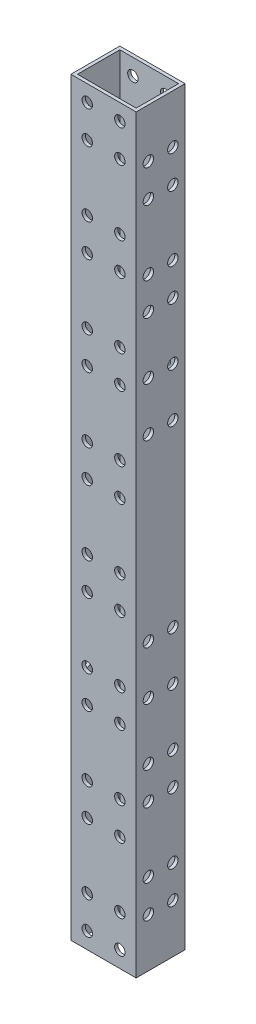
from build123d import *

# Parameters (mm, degrees)
SKETCH_1_W          = 20
SKETCH_1_H          = 15
SKETCH_1_W_2        = 18
SKETCH_1_H_2        = 13
EXTRUDE_1_DEPTH     = 230
SKETCH_3_R          = 1.6
CUT_EXTRUDE_1_DEPTH = 231.989718386
SKETCH_4_R          = 1.6
CUT_EXTRUDE_2_DEPTH = 231.705439901


with BuildPart() as part:
    # 草图1 → 拉伸-薄壁1 (new body)
    with BuildSketch(Plane(origin=(0, 0, 0), x_dir=(1, 0, 0), z_dir=(0, 1, 0))):
        Rectangle(SKETCH_1_W, SKETCH_1_H)
        Rectangle(SKETCH_1_W_2, SKETCH_1_H_2, mode=Mode.SUBTRACT)
    extrude(amount=EXTRUDE_1_DEPTH)

    # 草图3 → 切除-拉伸1 (cut, through all)
    with BuildSketch(Plane(origin=(10, 0, 0), x_dir=(0, 0, -1), z_dir=(1, 0, 0))):
        with Locations((-3.75, 157.5)):
            Circle(SKETCH_3_R)
        with Locations((-3.75, 142.5)):
            Circle(SKETCH_3_R)
        with Locations((3.75, 142.5)):
            Circle(SKETCH_3_R)
        with Locations((3.75, 157.5)):
            Circle(SKETCH_3_R)
        with Locations((-3.75, 87.5)):
            Circle(SKETCH_3_R)
        with Locations((3.75, 87.5)):
            Circle(SKETCH_3_R)
        with Locations((3.75, 72.5)):
            Circle(SKETCH_3_R)
        with Locations((-3.75, 72.5)):
            Circle(SKETCH_3_R)
        with Locations((-3.75, 215)):
            Circle(SKETCH_3_R)
        with Locations((3.75, 215)):
            Circle(SKETCH_3_R)
        with Locations((3.75, 205)):
            Circle(SKETCH_3_R)
        with Locations((-3.75, 205)):
            Circle(SKETCH_3_R)
        with Locations((-3.75, 185)):
            Circle(SKETCH_3_R)
        with Locations((3.75, 185)):
            Circle(SKETCH_3_R)
        with Locations((-3.75, 175)):
            Circle(SKETCH_3_R)
        with Locations((3.75, 175)):
            Circle(SKETCH_3_R)
        with Locations((3.75, 55)):
            Circle(SKETCH_3_R)
        with Locations((-3.75, 55)):
            Circle(SKETCH_3_R)
        with Locations((3.75, 45)):
            Circle(SKETCH_3_R)
        with Locations((-3.75, 45)):
            Circle(SKETCH_3_R)
        with Locations((-3.75, 25)):
            Circle(SKETCH_3_R)
        with Locations((3.75, 25)):
            Circle(SKETCH_3_R)
        with Locations((3.75, 15)):
            Circle(SKETCH_3_R)
        with Locations((-3.75, 15)):
            Circle(SKETCH_3_R)
    extrude(amount=-CUT_EXTRUDE_1_DEPTH, mode=Mode.SUBTRACT)

    # 草图4 → 切除-拉伸2 (cut, through all)
    with BuildSketch(Plane(origin=(0, 0, -7.5), x_dir=(-1, 0, 0), z_dir=(0, 0, -1))):
        with Locations((5, 225)):
            Circle(SKETCH_4_R)
        with Locations((-5, 225)):
            Circle(SKETCH_4_R)
        with Locations((5, 215)):
            Circle(SKETCH_4_R)
        with Locations((-5, 215)):
            Circle(SKETCH_4_R)
        with Locations((-5, 195)):
            Circle(SKETCH_4_R)
        with Locations((5, 195)):
            Circle(SKETCH_4_R)
        with Locations((-5, 185)):
            Circle(SKETCH_4_R)
        with Locations((5, 185)):
            Circle(SKETCH_4_R)
        with Locations((-5, 165)):
            Circle(SKETCH_4_R)
        with Locations((5, 165)):
            Circle(SKETCH_4_R)
        with Locations((-5, 155)):
            Circle(SKETCH_4_R)
        with Locations((5, 155)):
            Circle(SKETCH_4_R)
        with Locations((-5, 135)):
            Circle(SKETCH_4_R)
        with Locations((5, 135)):
            Circle(SKETCH_4_R)
        with Locations((-5, 125)):
            Circle(SKETCH_4_R)
        with Locations((5, 125)):
            Circle(SKETCH_4_R)
        with Locations((-5, 105)):
            Circle(SKETCH_4_R)
        with Locations((5, 105)):
            Circle(SKETCH_4_R)
        with Locations((-5, 95)):
            Circle(SKETCH_4_R)
        with Locations((5, 95)):
            Circle(SKETCH_4_R)
        with Locations((-5, 75)):
            Circle(SKETCH_4_R)
        with Locations((5, 75)):
            Circle(SKETCH_4_R)
        with Locations((-5, 65)):
            Circle(SKETCH_4_R)
        with Locations((5, 65)):
            Circle(SKETCH_4_R)
        with Locations((-5, 45)):
            Circle(SKETCH_4_R)
        with Locations((5, 45)):
            Circle(SKETCH_4_R)
        with Locations((-5, 35)):
            Circle(SKETCH_4_R)
        with Locations((5, 35)):
            Circle(SKETCH_4_R)
        with Locations((-5, 15)):
            Circle(SKETCH_4_R)
        with Locations((5, 15)):
            Circle(SKETCH_4_R)
        with Locations((-5, 5)):
            Circle(SKETCH_4_R)
        with Locations((5, 5)):
            Circle(SKETCH_4_R)
    extrude(amount=-CUT_EXTRUDE_2_DEPTH, mode=Mode.SUBTRACT)


solid = part.part
